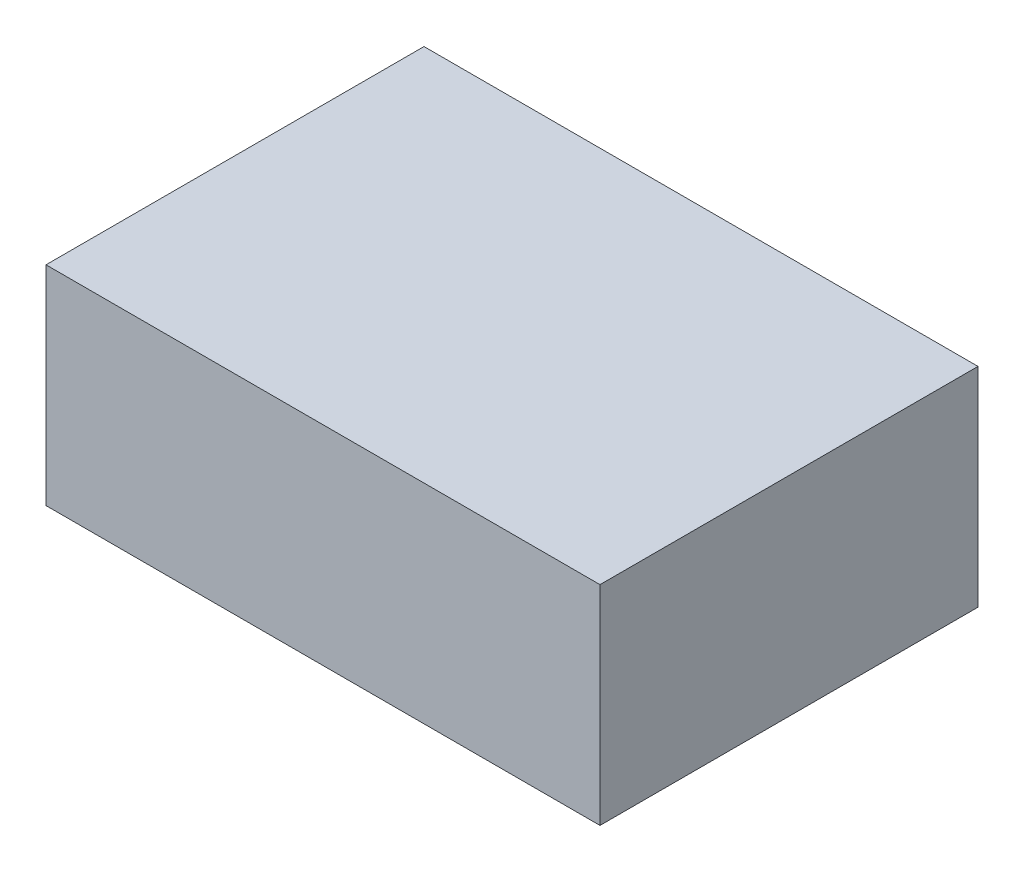
from build123d import *

# Parameters (mm, degrees)
SKETCH_1_W      = 85
SKETCH_1_H      = 58
EXTRUDE_1_DEPTH = 32


with BuildPart() as part:
    # 草图1 → 凸台-拉伸1 (new body)
    with BuildSketch(Plane(origin=(0, 0, 0), x_dir=(1, 0, 0), z_dir=(0, 1, 0))):
        with Locations((42.5, 29)):
            Rectangle(SKETCH_1_W, SKETCH_1_H)
    extrude(amount=EXTRUDE_1_DEPTH)


solid = part.part
